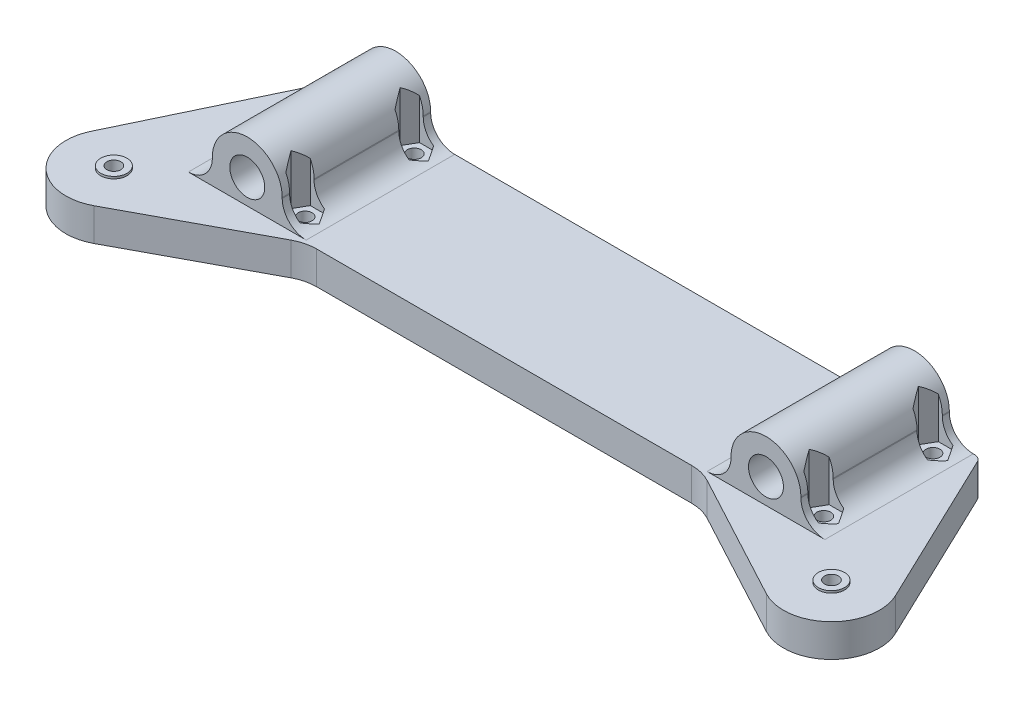
from build123d import *

# Parameters (mm, degrees)
SKETCH1_W               = 30
SKETCH1_H               = 34
BOSS_EXTRUDE1_DEPTH     = 7.5
BOSS_EXTRUDE2_DEPTH     = 34
CUT_EXTRUDE2_DEPTH      = 34
CUT_EXTRUDE2_DEPTH_BACK = 34
SKETCH5_R               = 1.6
CUT_EXTRUDE3_DEPTH      = 34
SKETCH6_R               = 1.6
BOSS_EXTRUDE3_DEPTH     = 7.5
SKETCH7_R               = 3
SKETCH7_R_2             = 1.6
BOSS_EXTRUDE4_DEPTH     = 0.5
FILLET1_R               = 2
BOSS_EXTRUDE5_START     = -7.5
BOSS_EXTRUDE5_DEPTH     = 7.5
FILLET2_R               = 10


with BuildPart() as part:
    # Sketch1 → Boss-Extrude1 (new body)
    with BuildSketch(Plane(origin=(0, 0, 0), x_dir=(1, 0, 0), z_dir=(0, 1, 0))):
        Rectangle(SKETCH1_W, SKETCH1_H)
    extrude(amount=BOSS_EXTRUDE1_DEPTH)

    # Sketch2 → Boss-Extrude2 (add)
    with BuildSketch(Plane.XY.offset(17)):
        with BuildLine():
            ThreePointArc((8, 13.207420741), (5.656854249, 18.86427499), (0, 21.207420741))
            Line((0, 21.207420741), (0, 17.207420741))
            ThreePointArc((0, 17.207420741), (2.828427125, 16.035847865), (4, 13.207420741))
            ThreePointArc((4, 13.207420741), (2.828427125, 10.378993616), (0, 9.207420741))
            Line((0, 9.207420741), (0, 7.5))
            Line((0, 7.5), (5.60583165, 7.5))
            ThreePointArc((5.60583165, 7.5), (7.377216725, 10.112800667), (8, 13.207420741))
        make_face()
        with BuildLine():
            ThreePointArc((0, 21.207420741), (-5.656854249, 18.86427499), (-8, 13.207420741))
            ThreePointArc((-8, 13.207420741), (-7.377216725, 10.112800667), (-5.60583165, 7.5))
            Line((-5.60583165, 7.5), (0, 7.5))
            Line((0, 7.5), (0, 9.207420741))
            ThreePointArc((0, 9.207420741), (-4, 13.207420741), (0, 17.207420741))
            Line((0, 17.207420741), (0, 21.207420741))
        make_face()
        with BuildLine():
            Line((8, 13), (8, 13.207420741))
            ThreePointArc((8, 13.207420741), (7.377216725, 10.112800667), (5.60583165, 7.5))
            Line((5.60583165, 7.5), (13.5, 7.5))
            ThreePointArc((13.5, 7.5), (9.610912703, 9.110912703), (8, 13))
        make_face()
        with BuildLine():
            ThreePointArc((-5.60583165, 7.5), (-7.377216725, 10.112800667), (-8, 13.207420741))
            Line((-8, 13.207420741), (-8, 13))
            ThreePointArc((-8, 13), (-9.610912703, 9.110912703), (-13.5, 7.5))
            Line((-13.5, 7.5), (-5.60583165, 7.5))
        make_face()
    extrude(amount=-BOSS_EXTRUDE2_DEPTH)

    # Sketch5 → Cut-Extrude2 (cut, two sides: drawn at the far end of the back side and taken through both)
    with BuildSketch(Plane(origin=(0, 7.5, 0), x_dir=(1, 0, 0), z_dir=(0, 1, 0)).offset(-CUT_EXTRUDE2_DEPTH_BACK)):
        with Locations(Location((-8.75, 12.5, 0), (0, 0, 62.046813117))):
            Circle(SKETCH5_R)
        with Locations(Location((8.75, 12.5, 0), (0, 0, 117.953186883))):
            Circle(SKETCH5_R)
        with Locations(Location((-8.75, -12.5, 0), (0, 0, 62.046813117))):
            Circle(SKETCH5_R)
        with Locations(Location((8.75, -12.5, 0), (0, 0, 117.953186883))):
            Circle(SKETCH5_R)
    extrude(amount=CUT_EXTRUDE2_DEPTH + CUT_EXTRUDE2_DEPTH_BACK, mode=Mode.SUBTRACT)

    # Sketch5<3> → Cut-Extrude3 (cut)
    with BuildSketch(Plane(origin=(0, 7.5, 0), x_dir=(1, 0, 0), z_dir=(0, 1, 0))):
        Polygon((7.133419246, -9.7), (10.366580754, -9.7), (11.983161507, -12.5), (10.366580754, -15.3), (7.133419246, -15.3), (5.516838493, -12.5), align=None)
        Polygon((-12.098631561, 12.5), (-10.424315781, 9.6), (-7.075684219, 9.6), (-5.401368439, 12.5), (-7.075684219, 15.4), (-10.424315781, 15.4), align=None)
        Polygon((5.516838493, 12.5), (7.133419246, 9.7), (10.366580754, 9.7), (11.983161507, 12.5), (10.366580754, 15.3), (7.133419246, 15.3), align=None)
        Polygon((-7.075684219, -9.6), (-5.401368439, -12.5), (-7.075684219, -15.4), (-10.424315781, -15.4), (-12.098631561, -12.5), (-10.424315781, -9.6), align=None)
    extrude(amount=CUT_EXTRUDE3_DEPTH, mode=Mode.SUBTRACT)

    # Sketch6 → Boss-Extrude3 (add)
    with BuildSketch(Plane.XZ):
        with BuildLine():
            Line((-32.702629656, 20.034210881), (-15, -17))
            Line((-15, -17), (-15, 17))
            Line((-15, 17), (15, 17))
            Line((15, 17), (-17.579374925, 34.472115072))
            ThreePointArc((-17.579374925, 34.472115072), (-30.37397765, 32.734541598), (-32.702629656, 20.034210881))
        make_face()
        with Locations(Location((-22.778174593, 24.778174593, 0), (0, 0, 270))):
            Circle(SKETCH6_R, mode=Mode.SUBTRACT)
    extrude(amount=-BOSS_EXTRUDE3_DEPTH)

    # Sketch7 → Boss-Extrude4 (add)
    with BuildSketch(Plane(origin=(0, 7.5, 0), x_dir=(1, 0, 0), z_dir=(0, 1, 0))):
        with Locations(Location((-22.778174593, -24.778174593, 0), (0, 0, 270))):
            Circle(SKETCH7_R)
        with Locations(Location((-22.778174593, -24.778174593, 0), (0, 0, 90))):
            Circle(SKETCH7_R_2, mode=Mode.SUBTRACT)
    extrude(amount=BOSS_EXTRUDE4_DEPTH)

    # Fillet1
    fillet1_edges = [part.edges().sort_by_distance(p)[0] for p in [
        (-15, 3.75, -17),
        (15, 3.75, -17),
        (15, 3.75, 17),
    ]]
    fillet(fillet1_edges, radius=FILLET1_R)

    # Sketch8 → Boss-Extrude5 (add)
    with BuildSketch(Plane.XZ.offset(BOSS_EXTRUDE5_START)):
        with BuildLine():
            ThreePointArc((15, -15), (14.414213562, -16.414213562), (13, -17))
            Line((13, -17), (59.4, -17))
            Line((59.4, -17), (59.4, 17.565663176))
            Line((59.4, 17.565663176), (13.945236303, 17.565663176))
            ThreePointArc((13.945236303, 17.565663176), (14.716169078, 16.830145435), (15, 15.803128543))
            Line((15, 15.803128543), (15, -15))
        make_face()
    extrude(amount=BOSS_EXTRUDE5_DEPTH)

    # Mirror3: part across plane


with BuildPart() as part_1:
    add(part.part)
    add(part.part.mirror(Plane(origin=(59.4, 7.5, 0), x_dir=(0, 0, 1), z_dir=(-1, 0, 0))))

    # Fillet2
    fillet2_edges = [part_1.edges().sort_by_distance(p)[0] for p in [
        (13.945236303, 3.75, 17.565663176),
        (104.854763697, 3.75, 17.565663176),
    ]]
    fillet(fillet2_edges, radius=FILLET2_R)


solid = part_1.part
